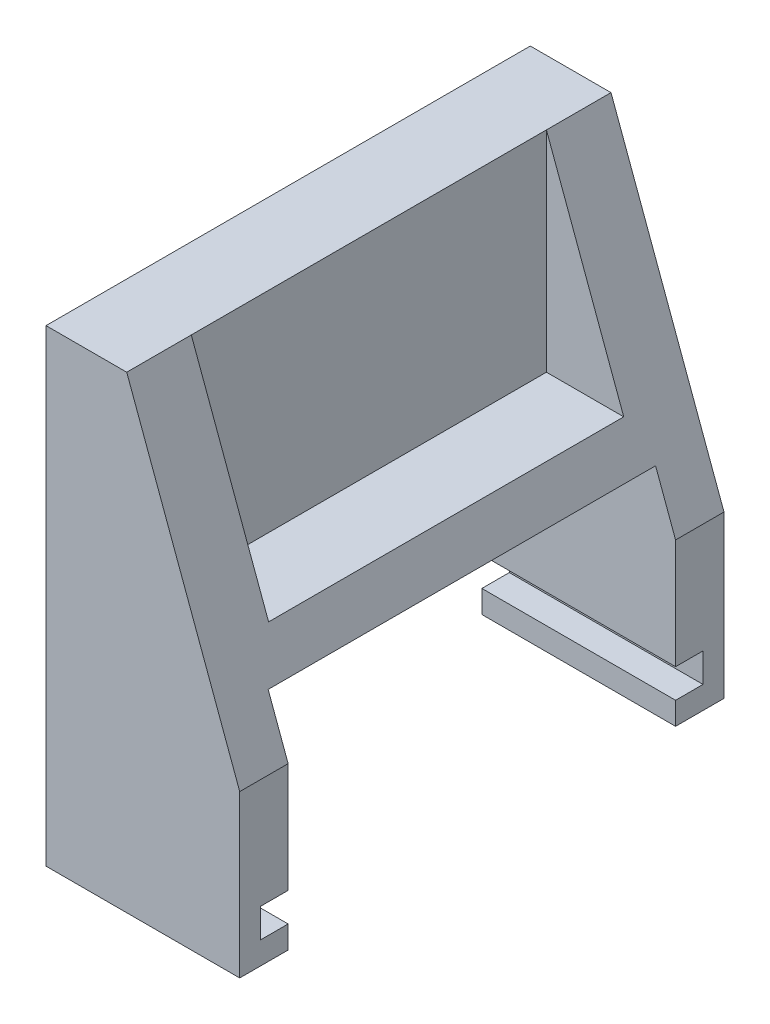
from build123d import *

# Parameters (mm, degrees)
BOSS_EXTRUDE1_DEPTH = 30
SKETCH4_W           = 24
SKETCH4_H           = 14
CUT_EXTRUDE2_DEPTH  = 25
SKETCH5_W           = 1.7
SKETCH5_H           = 1.8
CUT_EXTRUDE3_DEPTH  = 15
CUT_EXTRUDE4_DEPTH  = 11


with BuildPart() as part:
    # Sketch1 → Boss-Extrude1 (new body)
    with BuildSketch(Plane.XY):
        Polygon((0, 0), (0, -29), (12, -29), (12, -19), (5, 0), align=None)
    extrude(amount=-BOSS_EXTRUDE1_DEPTH)

    # Sketch4 → Cut-Extrude2 (cut)
    with BuildSketch(Plane.ZY):
        with Locations((-15, -22.638599401)):
            Rectangle(SKETCH4_W, SKETCH4_H)
    extrude(amount=-CUT_EXTRUDE2_DEPTH, mode=Mode.SUBTRACT)

    # Sketch5 → Cut-Extrude3 (cut)
    with BuildSketch(Plane.ZY):
        with Locations((-2.15, -26.7)):
            Rectangle(SKETCH5_W, SKETCH5_H)
    cut_extrude3 = extrude(amount=-CUT_EXTRUDE3_DEPTH, mode=Mode.SUBTRACT)

    # Mirror1: Cut-Extrude3 across plane
    add(cut_extrude3.mirror(Plane.XY.offset(-15)), mode=Mode.SUBTRACT)

    # Sketch6 → Cut-Extrude4 (cut, symmetric)
    with BuildSketch(Plane.XY.offset(-15)):
        Polygon((5, 0), (5, -13), (9.789473684, -13), align=None)
    extrude(amount=CUT_EXTRUDE4_DEPTH, both=True, mode=Mode.SUBTRACT)


solid = part.part
